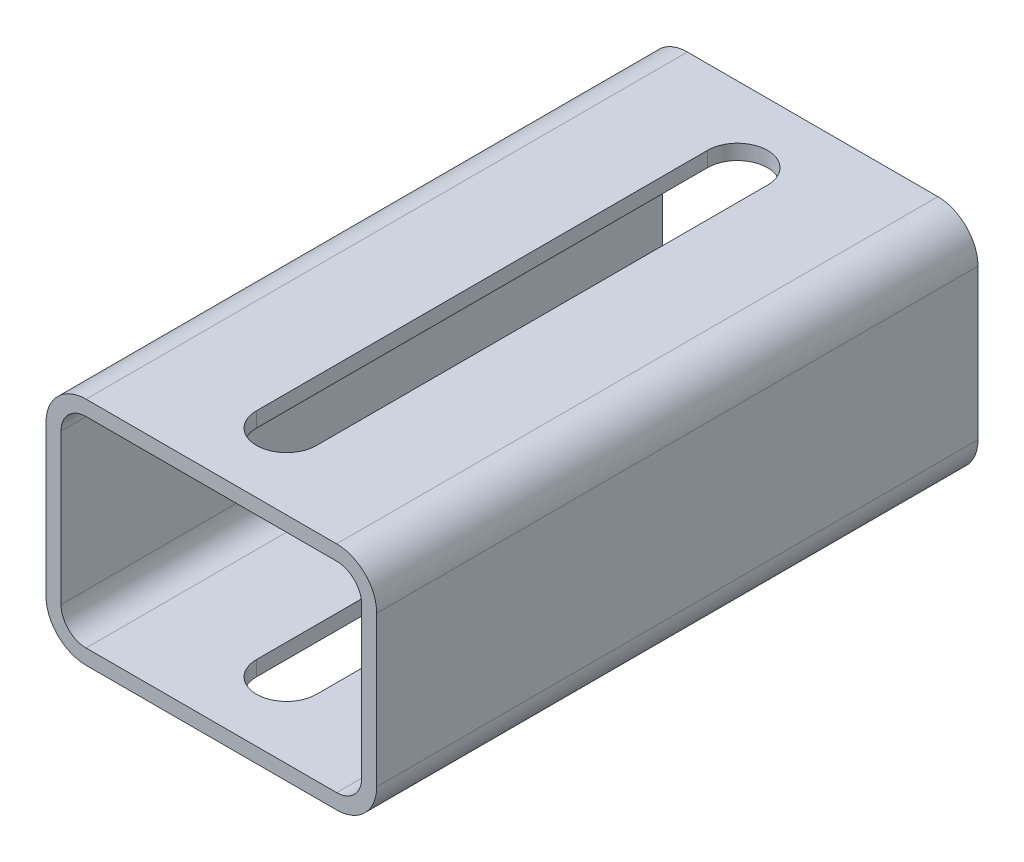
from build123d import *

# Parameters (mm, degrees)
EXTRUDE_THIN1_DEPTH = 60
CUT_EXTRUDE1_DEPTH  = 83.492423895


with BuildPart() as part:
    # Sketch1 → Extrude-Thin1 (new, symmetric)
    with BuildSketch(Plane.XY):
        with BuildLine():
            Line((-25, 23), (25, 23))
            ThreePointArc((25, 23), (30.656854249, 20.656854249), (33, 15))
            Line((33, 15), (33, -15))
            ThreePointArc((33, -15), (30.656854249, -20.656854249), (25, -23))
            Line((25, -23), (-25, -23))
            ThreePointArc((-25, -23), (-30.656854249, -20.656854249), (-33, -15))
            Line((-33, -15), (-33, 15))
            ThreePointArc((-33, 15), (-30.656854249, 20.656854249), (-25, 23))
        make_face()
        with BuildLine():
            Line((-25, 20), (25, 20))
            ThreePointArc((25, 20), (28.535533906, 18.535533906), (30, 15))
            Line((30, 15), (30, -15))
            ThreePointArc((30, -15), (28.535533906, -18.535533906), (25, -20))
            Line((25, -20), (-25, -20))
            ThreePointArc((-25, -20), (-28.535533906, -18.535533906), (-30, -15))
            Line((-30, -15), (-30, 15))
            ThreePointArc((-30, 15), (-28.535533906, 18.535533906), (-25, 20))
        make_face(mode=Mode.SUBTRACT)
    extrude(amount=EXTRUDE_THIN1_DEPTH, both=True)

    # Sketch2 → Cut-Extrude1 (cut, through all)
    with BuildSketch(Plane(origin=(0, 23, 0), x_dir=(1, 0, 0), z_dir=(0, 1, 0))):
        with BuildLine():
            Line((6, 45), (6, -45))
            ThreePointArc((6, -45), (0, -51), (-6, -45))
            Line((-6, -45), (-6, 45))
            ThreePointArc((-6, 45), (0, 51), (6, 45))
        make_face()
    extrude(amount=-CUT_EXTRUDE1_DEPTH, mode=Mode.SUBTRACT)


solid = part.part
